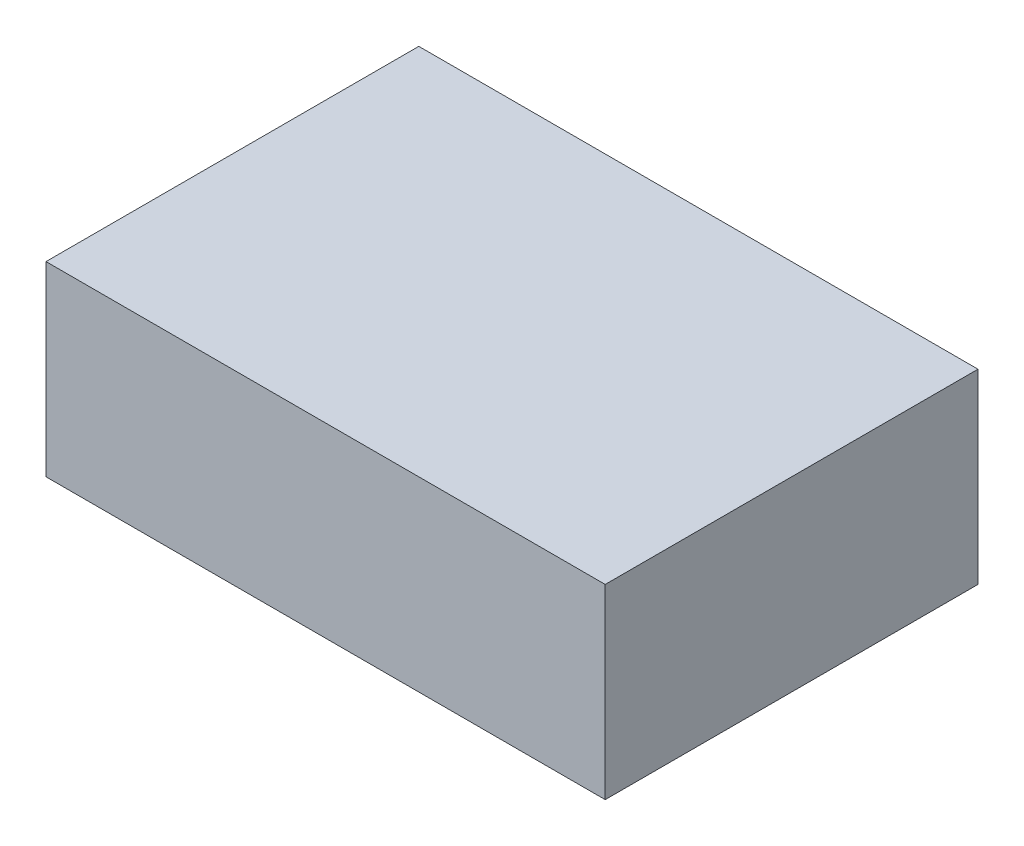
from build123d import *

# Parameters (mm, degrees)
SKETCH1_W           = 150
SKETCH1_H           = 50
BOSS_EXTRUDE1_DEPTH = 100
SKETCH2_W           = 53.64701246
SKETCH2_H           = 70
CUT_EXTRUDE1_DEPTH  = 30


with BuildPart() as part:
    # Sketch1 → Boss-Extrude1 (new body)
    with BuildSketch(Plane.XY):
        with Locations((75, 25)):
            Rectangle(SKETCH1_W, SKETCH1_H)
    extrude(amount=BOSS_EXTRUDE1_DEPTH)

    # Sketch2 → Cut-Extrude1 (cut)
    with BuildSketch(Plane.XZ):
        with Locations((26.82350623, 50)):
            Rectangle(SKETCH2_W, SKETCH2_H)
    extrude(amount=-CUT_EXTRUDE1_DEPTH, mode=Mode.SUBTRACT)


solid = part.part
